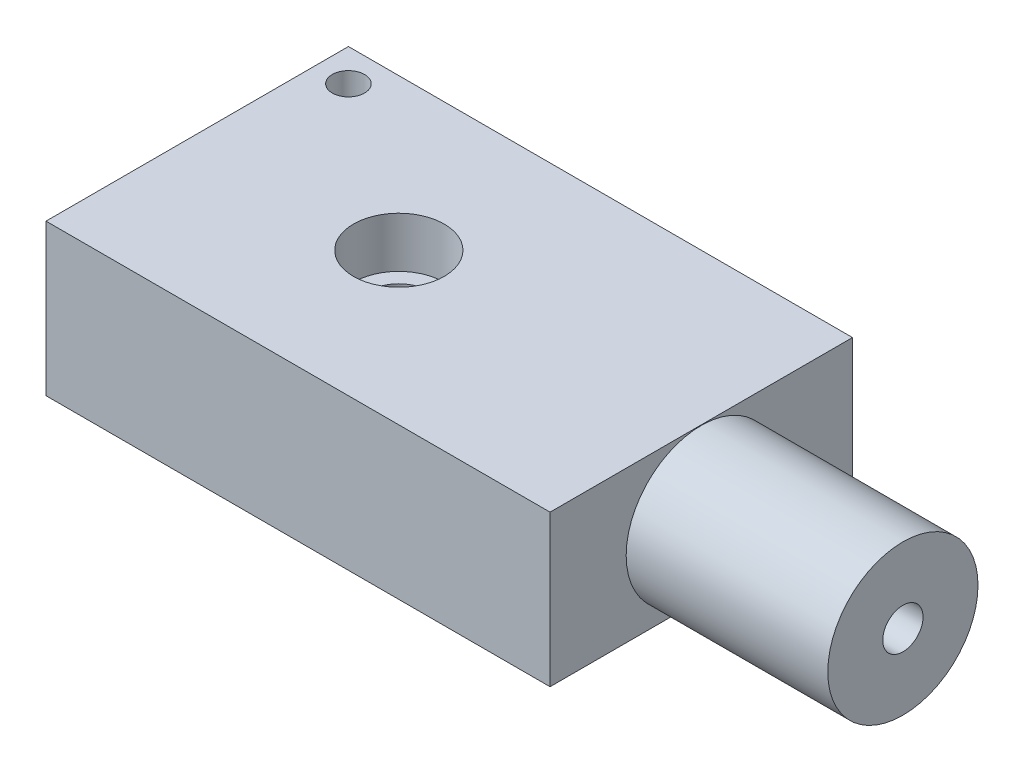
from build123d import *

# Parameters (mm, degrees)
SKETCH1_W           = 25
SKETCH1_H           = 15
BOSS_EXTRUDE1_DEPTH = 7.5
SKETCH2_R           = 3.725
BOSS_EXTRUDE2_DEPTH = 10
SKETCH3_R           = 1
CUT_EXTRUDE1_DEPTH  = 3
SKETCH4_W           = 10
SKETCH4_H           = 4
CUT_EXTRUDE2_DEPTH  = 5
SKETCH5_R           = 0.8
CUT_EXTRUDE3_DEPTH  = 7.5
SKETCH6_R           = 1.5
CUT_EXTRUDE4_DEPTH  = 7.5
SKETCH6_3_R         = 2.25
SKETCH6_3_R_2       = 1.5
CUT_EXTRUDE5_DEPTH  = 2.5
CUT_EXTRUDE6_START  = -2.5
SKETCH7_R           = 2.25
CUT_EXTRUDE6_DEPTH  = 2.5


with BuildPart() as part:
    # Sketch1 → Boss-Extrude1 (new body)
    with BuildSketch(Plane(origin=(0, 0, 0), x_dir=(1, 0, 0), z_dir=(0, 1, 0))):
        with Locations((-9.465160398, -5.033961787)):
            Rectangle(SKETCH1_W, SKETCH1_H)
    extrude(amount=BOSS_EXTRUDE1_DEPTH)

    # Sketch2 → Boss-Extrude2 (add)
    with BuildSketch(Plane(origin=(3.034839602, 0, 0), x_dir=(0, 0, -1), z_dir=(1, 0, 0))):
        with Locations((-5.033961787, 3.75)):
            Circle(SKETCH2_R)
    extrude(amount=BOSS_EXTRUDE2_DEPTH)

    # Sketch3 → Cut-Extrude1 (cut)
    with BuildSketch(Plane(origin=(13.034839602, 0, 0), x_dir=(0, 0, -1), z_dir=(1, 0, 0))):
        with Locations((-5.033961787, 3.75)):
            Circle(SKETCH3_R)
    extrude(amount=-CUT_EXTRUDE1_DEPTH, mode=Mode.SUBTRACT)

    # Sketch4 → Cut-Extrude2 (cut)
    with BuildSketch(Plane.ZY.offset(21.965160398)):
        with Locations((2.533961787, 3.75)):
            Rectangle(SKETCH4_W, SKETCH4_H)
    extrude(amount=-CUT_EXTRUDE2_DEPTH, mode=Mode.SUBTRACT)

    # Sketch5 → Cut-Extrude3 (cut)
    with BuildSketch(Plane(origin=(0, 7.5, 0), x_dir=(1, 0, 0), z_dir=(0, 1, 0))):
        with Locations((-20.365160398, 0.866038213)):
            Circle(SKETCH5_R)
    extrude(amount=-CUT_EXTRUDE3_DEPTH, mode=Mode.SUBTRACT)

    # Sketch6 → Cut-Extrude4 (cut)
    with BuildSketch(Plane(origin=(0, 7.5, 0), x_dir=(1, 0, 0), z_dir=(0, 1, 0))):
        with Locations((-11.965160398, -5.033961787)):
            Circle(SKETCH6_R)
    extrude(amount=-CUT_EXTRUDE4_DEPTH, mode=Mode.SUBTRACT)

    # Sketch6<3> → Cut-Extrude5 (cut)
    with BuildSketch(Plane(origin=(0, 7.5, 0), x_dir=(1, 0, 0), z_dir=(0, 1, 0))):
        with Locations((-11.965160398, -5.033961787)):
            Circle(SKETCH6_3_R)
        with Locations((-11.965160398, -5.033961787)):
            Circle(SKETCH6_3_R_2, mode=Mode.SUBTRACT)
    extrude(amount=-CUT_EXTRUDE5_DEPTH, mode=Mode.SUBTRACT)

    # Sketch7 → Cut-Extrude6 (cut)
    with BuildSketch(Plane.XZ.offset(CUT_EXTRUDE6_START)):
        with Locations((-11.965160398, 5.033961787)):
            Circle(SKETCH7_R)
    extrude(amount=CUT_EXTRUDE6_DEPTH, mode=Mode.SUBTRACT)


solid = part.part
